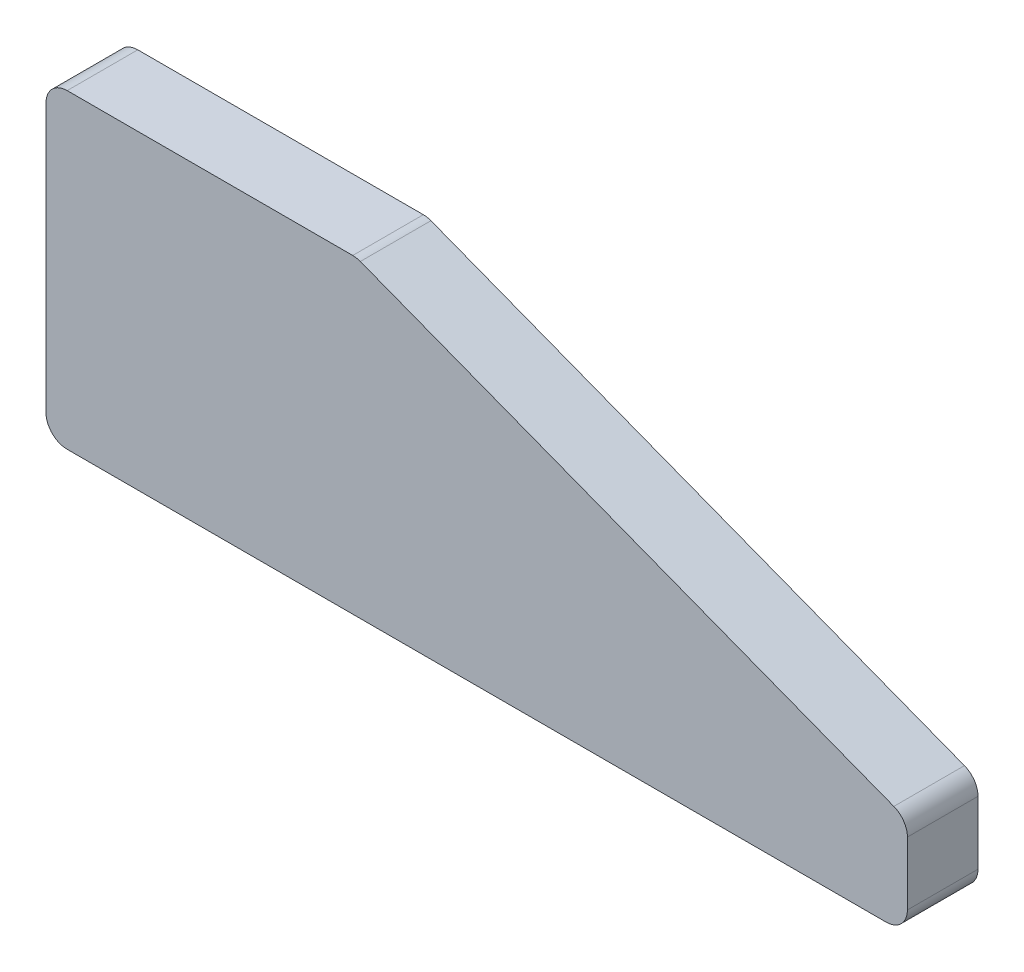
from build123d import *

# Parameters (mm, degrees)
EXTRUDE_436_DEPTH = 5
FILLET_R_R        = 3


with BuildPart() as part:
    # ｽｹｯﾁ1 → Extrude 436 (new, symmetric)
    with BuildSketch(Plane.XY):
        Polygon((-22, -22), (100, -22), (100, -8), (22, 22), (-22, 22), align=None)
    extrude(amount=EXTRUDE_436_DEPTH, both=True)

    # 角R
    fillet_r_edges = [part.edges().sort_by_distance(p)[0] for p in [
        (-22, 22, 0),
        (22, 22, 0),
        (100, -8, 0),
        (100, -22, 0),
        (-22, -22, 0),
    ]]
    fillet(fillet_r_edges, radius=FILLET_R_R)


solid = part.part
